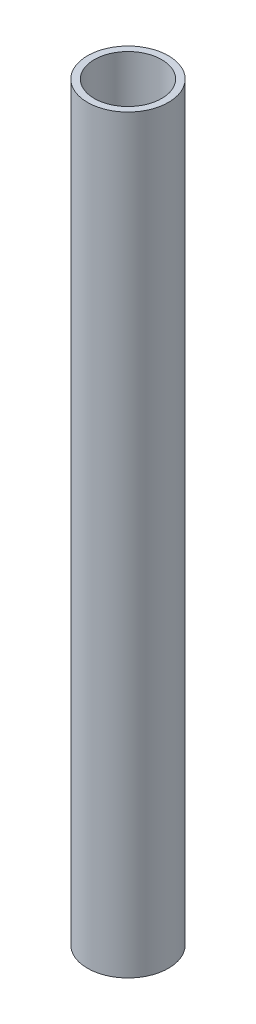
from build123d import *

# Parameters (mm, degrees)
SKETCH_1_R      = 3
SKETCH_1_R_2    = 2.5
EXTRUDE_1_DEPTH = 55.6


with BuildPart() as part:
    # 草图1 → 凸台-拉伸1 (new body)
    with BuildSketch(Plane(origin=(0, 0, 0), x_dir=(1, 0, 0), z_dir=(0, 1, 0))):
        with Locations(Location((0, 0, 0), (0, 0, 270))):
            Circle(SKETCH_1_R)
        with Locations(Location((0, 0, 0), (0, 0, 270))):
            Circle(SKETCH_1_R_2, mode=Mode.SUBTRACT)
    extrude(amount=EXTRUDE_1_DEPTH)


solid = part.part
